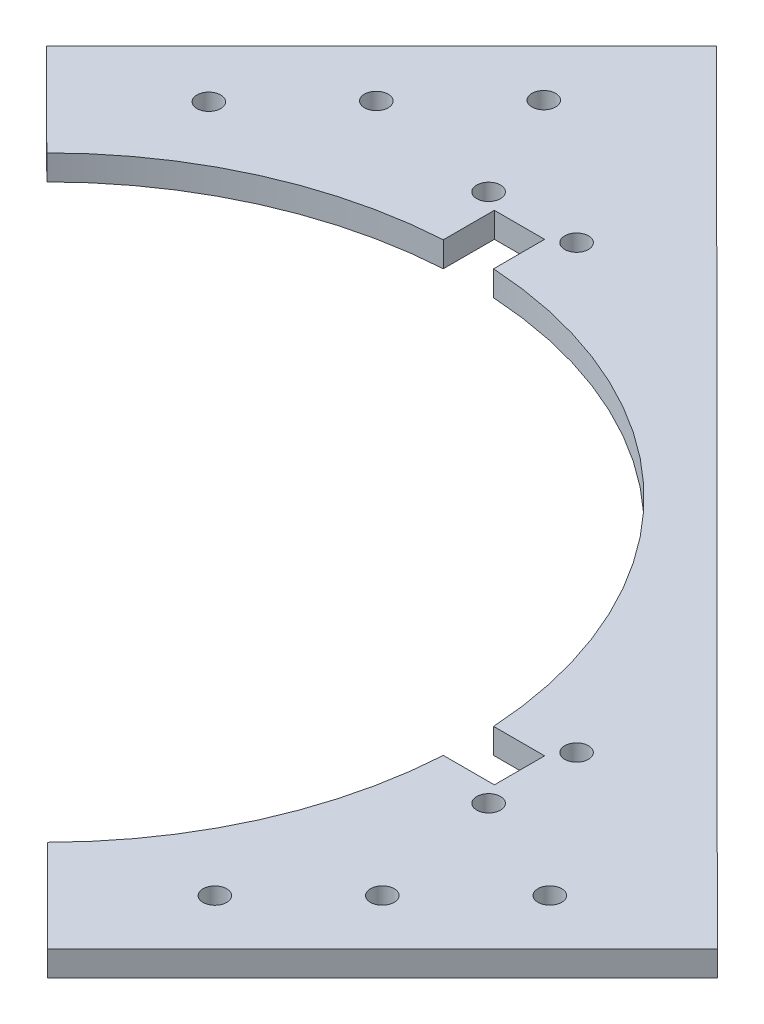
from build123d import *

# Parameters (mm, degrees)
SKETCH1_R           = 1.5
SKETCH1_R_2         = 53.34
BOSS_EXTRUDE1_DEPTH = 3.175
CUT_EXTRUDE3_DEPTH  = 140.736059076
CUT_EXTRUDE4_DEPTH  = 140.736059076
CUT_EXTRUDE5_DEPTH  = 140.736059076
SKETCH6_R           = 1.5
CUT_EXTRUDE6_DEPTH  = 130.738840902


with BuildPart() as part:
    # Sketch1 → Boss-Extrude1 (new body)
    with BuildSketch(Plane(origin=(0, 0, 0), x_dir=(1, 0, 0), z_dir=(0, 1, 0))):
        Polygon((0.047005036, -98.782806148), (-98.782806148, -0.047005036), (-0.047005036, 98.782806148), (98.782806148, 0.047005036), align=None)
        with Locations(Location((-61.346730494, 5.55625, 0), (0, 0, 270))):
            Circle(SKETCH1_R, mode=Mode.SUBTRACT)
        with Locations(Location((-61.346730494, -5.55625, 0), (0, 0, 270))):
            Circle(SKETCH1_R, mode=Mode.SUBTRACT)
        with Locations(Location((-5.55625, -61.346730494, 0), (0, 0, 270))):
            Circle(SKETCH1_R, mode=Mode.SUBTRACT)
        with Locations(Location((5.55625, -61.346730494, 0), (0, 0, 270))):
            Circle(SKETCH1_R, mode=Mode.SUBTRACT)
        with Locations(Location((61.346730494, -5.55625, 0), (0, 0, 270))):
            Circle(SKETCH1_R, mode=Mode.SUBTRACT)
        with Locations(Location((61.346730494, 5.55625, 0), (0, 0, 270))):
            Circle(SKETCH1_R, mode=Mode.SUBTRACT)
        with Locations(Location((5.55625, 61.346730494, 0), (0, 0, 270))):
            Circle(SKETCH1_R, mode=Mode.SUBTRACT)
        with Locations(Location((-5.55625, 61.346730494, 0), (0, 0, 270))):
            Circle(SKETCH1_R, mode=Mode.SUBTRACT)
        with Locations(Location((0, 0, 0), (0, 0, 270))):
            Circle(SKETCH1_R_2, mode=Mode.SUBTRACT)
    extrude(amount=BOSS_EXTRUDE1_DEPTH)

    # Sketch2 → Cut-Extrude3 (cut, through all)
    with BuildSketch(Plane(origin=(0, 3.175, 0), x_dir=(1, 0, 0), z_dir=(0, 1, 0))):
        Polygon((3.175, 53.34), (3.175, 59.69), (-3.175, 59.69), (-3.175, 53.34), (-3.175, 52.244537665), (3.175, 52.244537665), align=None)
        Polygon((53.34, -3.175), (59.69, -3.175), (59.69, 3.175), (53.34, 3.175), (52.244537665, 3.175), (52.244537665, -3.175), align=None)
        Polygon((-3.175, -53.34), (-3.175, -59.69), (3.175, -59.69), (3.175, -53.34), (3.175, -52.244537665), (-3.175, -52.244537665), align=None)
        Polygon((-53.34, 3.175), (-59.69, 3.175), (-59.69, -3.175), (-53.34, -3.175), (-52.244537665, -3.175), (-52.244537665, 3.175), align=None)
    extrude(amount=-CUT_EXTRUDE3_DEPTH, mode=Mode.SUBTRACT)

    # Sketch3 → Cut-Extrude4 (cut, through all)
    with BuildSketch(Plane(origin=(0, 3.175, 0), x_dir=(1, 0, 0), z_dir=(0, 1, 0))):
        Polygon((-49.414905592, 49.367900556), (49.414905592, -49.367900556), (0.047005036, -98.782806148), (-98.782806148, -0.047005036), align=None)
    extrude(amount=-CUT_EXTRUDE4_DEPTH, mode=Mode.SUBTRACT)

    # Sketch5 → Cut-Extrude5 (cut, through all)
    with BuildSketch(Plane(origin=(0, 3.175, 0), x_dir=(1, 0, 0), z_dir=(0, 1, 0))):
        Polygon((98.782806148, 0.047005036), (91.71510385, -7.027426688), (-7.114707335, 91.708374424), (-0.047005036, 98.782806148), align=None)
    extrude(amount=-CUT_EXTRUDE5_DEPTH, mode=Mode.SUBTRACT)

    # Sketch6 → Cut-Extrude6 (cut, through all)
    with BuildSketch(Plane(origin=(0, 3.175, 0), x_dir=(1, 0, 0), z_dir=(0, 1, 0))):
        with Locations(Location((64.725061333, -22.363275374, 0), (0, 0, 270))):
            Circle(SKETCH6_R)
        with Locations(Location((75.300110897, -11.778156907, 0), (0, 0, 270))):
            Circle(SKETCH6_R)
        with Locations(Location((-12.105083926, 74.865628777, 0), (0, 0, 90))):
            Circle(SKETCH6_R)
        with Locations(Location((-22.597274037, 64.198372666, 0), (0, 0, 90))):
            Circle(SKETCH6_R)
        with Locations(Location((54.150011768, -32.948393841, 0), (0, 0, 270))):
            Circle(SKETCH6_R)
        with Locations(Location((-33.089464147, 53.531116555, 0), (0, 0, 90))):
            Circle(SKETCH6_R)
    extrude(amount=-CUT_EXTRUDE6_DEPTH, mode=Mode.SUBTRACT)


solid = part.part
